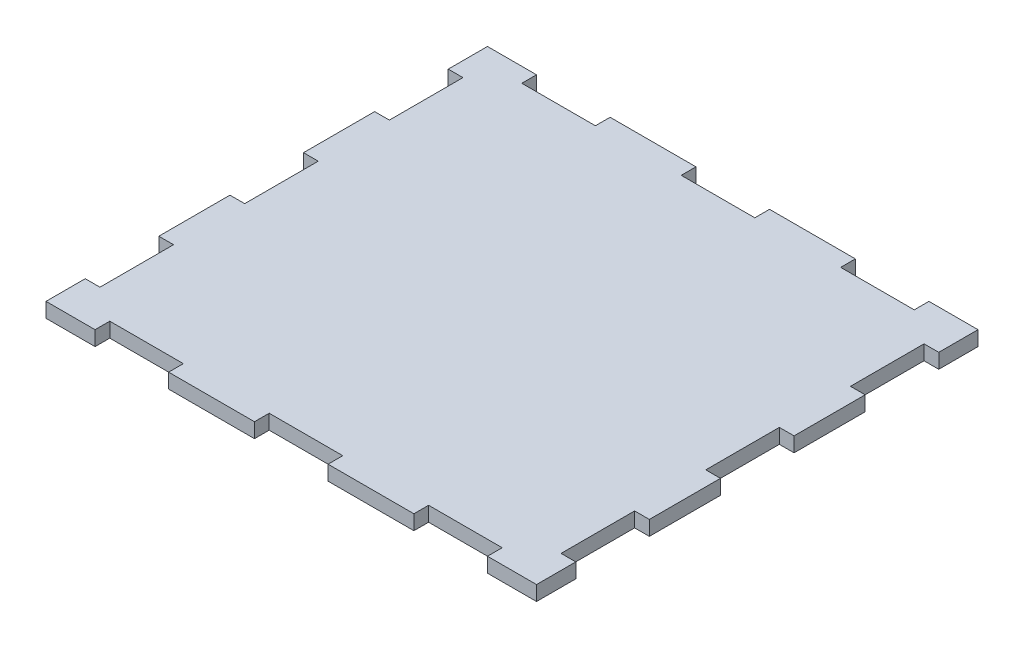
from build123d import *

# Parameters (mm, degrees)
EXTRUDE_1_DEPTH = 3


with BuildPart() as part:
    # 草图1 → 凸台-拉伸1 (new body)
    with BuildSketch(Plane(origin=(0, 0, 0), x_dir=(1, 0, 0), z_dir=(0, 1, 0))):
        Polygon((-50, -45), (-40, -45), (-40, -42), (-25, -42), (-25, -45), (-7.5, -45), (-7.5, -42), (7.5, -42), (7.5, -45), (25, -45), (25, -42), (40, -42), (40, -45), (50, -45), (50, -37), (47, -37), (47, -22), (50, -22), (50, -7.5), (47, -7.5), (47, 7.5), (50, 7.5), (50, 22), (47, 22), (47, 37), (50, 37), (50, 45), (40, 45), (40, 42), (25, 42), (25, 45), (7.5, 45), (7.5, 42), (-7.5, 42), (-7.5, 45), (-25, 45), (-25, 42), (-40, 42), (-40, 45), (-50, 45), (-50, 37), (-47, 37), (-47, 22), (-50, 22), (-50, 7.5), (-47, 7.5), (-47, -7.5), (-50, -7.5), (-50, -22), (-47, -22), (-47, -37), (-50, -37), align=None)
    extrude(amount=EXTRUDE_1_DEPTH)


solid = part.part
